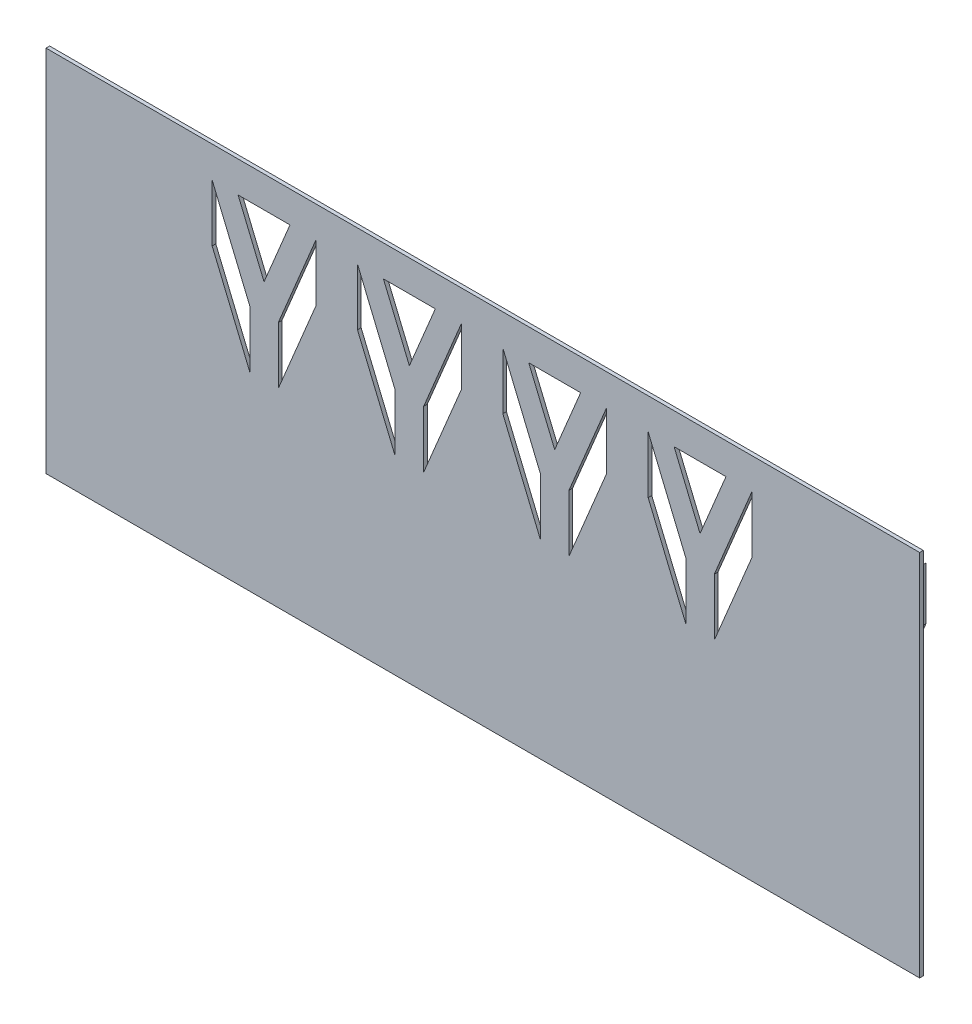
from build123d import *

# Parameters (mm, degrees)
SKETCH2_W           = 168.310893
SKETCH2_H           = 71
BOSS_EXTRUDE3_DEPTH = 0.7
BOSS_EXTRUDE5_DEPTH = 5


with BuildPart() as part:
    # Sketch2 → Boss-Extrude3 (new body)
    with BuildSketch(Plane.XY):
        with Locations((84.1554465, -35.5)):
            Rectangle(SKETCH2_W, SKETCH2_H)
        Polygon((32.004849, -17), (32.004849, -11.5), (32.004849, -6), (39.254849, -23.4), (39.254849, -34.4), align=None, mode=Mode.SUBTRACT)
        Polygon((52.004849, -6), (52.004849, -17), (44.754849, -34.4), (44.754849, -23.4), align=None, mode=Mode.SUBTRACT)
        Polygon((67.254849, -34.4), (60.004849, -17), (60.004849, -6), (67.254849, -23.4), align=None, mode=Mode.SUBTRACT)
        Polygon((80.004849, -17), (72.754849, -34.4), (72.754849, -23.4), (80.004849, -6), align=None, mode=Mode.SUBTRACT)
        Polygon((42.004849, -18), (37.004849, -6), (47.004849, -6), align=None, mode=Mode.SUBTRACT)
        Polygon((75.004849, -6), (70.004849, -18), (65.004849, -6), align=None, mode=Mode.SUBTRACT)
        Polygon((95.254849, -23.4), (95.254849, -34.4), (88.004849, -17), (88.004849, -6), align=None, mode=Mode.SUBTRACT)
        Polygon((100.754849, -23.4), (108.004849, -6), (108.004849, -17), (100.754849, -34.4), align=None, mode=Mode.SUBTRACT)
        Polygon((123.254849, -34.4), (116.004849, -17), (116.004849, -6), (123.254849, -23.4), align=None, mode=Mode.SUBTRACT)
        Polygon((136.004849, -6), (136.004849, -17), (128.754849, -34.4), (128.754849, -23.4), align=None, mode=Mode.SUBTRACT)
        Polygon((98.004849, -18), (93.004849, -6), (103.004849, -6), align=None, mode=Mode.SUBTRACT)
        Polygon((131.004849, -6), (126.004849, -18), (121.004849, -6), align=None, mode=Mode.SUBTRACT)
    extrude(amount=BOSS_EXTRUDE3_DEPTH)

    # Sketch2<6> → Boss-Extrude5 (add)
    with BuildSketch(Plane.XY):
        Polygon((158.749849, -6.17), (149.259849, -6.17), (154.004849, -17.558), align=None)
        Polygon((144.174849, -16.966), (151.084849, -33.55), (151.084849, -23.434), (144.174849, -6.85), align=None)
        Polygon((163.834849, -6.85), (156.924849, -23.434), (156.924849, -33.55), (163.834849, -16.966), align=None)
        Polygon((18.749849, -6.17), (9.259849, -6.17), (14.004849, -17.558), align=None)
        Polygon((11.084849, -23.434), (4.174849, -6.85), (4.174849, -16.966), (11.084849, -33.55), align=None)
        Polygon((23.834849, -16.966), (23.834849, -6.85), (16.924849, -23.434), (16.924849, -33.55), align=None)
    extrude(amount=-BOSS_EXTRUDE5_DEPTH)


solid = part.part
